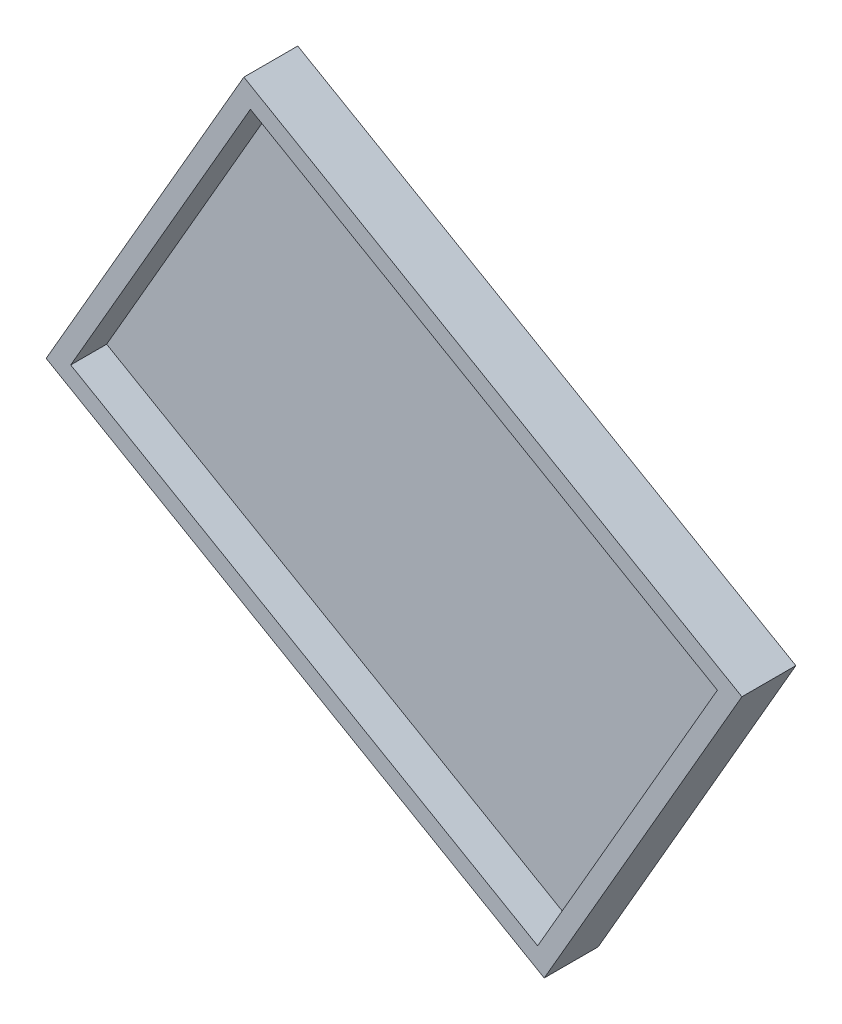
from build123d import *

# Parameters (mm, degrees)
BOSS_EXTRUDE1_DEPTH = 5
BOSS_EXTRUDE2_DEPTH = 10


with BuildPart() as part:
    # Sketch1 → Boss-Extrude1 (new body)
    with BuildSketch(Plane.XY):
        Polygon((75.131397208, 20.131397208), (20.131397208, -75.131397208), (158.695461814, -155.131397208), (213.695461814, -59.868602792), align=None)
    extrude(amount=BOSS_EXTRUDE1_DEPTH)

    # Sketch2 → Boss-Extrude2 (add)
    with BuildSketch(Plane.XY.offset(5)):
        Polygon((158.695461814, -155.131397208), (213.695461814, -59.868602792), (75.131397208, 20.131397208), (20.131397208, -75.131397208), align=None)
        Polygon((26.961524227, -73.301270189), (156.865334795, -148.301270189), (206.865334795, -61.698729811), (76.961524227, 13.301270189), align=None, mode=Mode.SUBTRACT)
    extrude(amount=BOSS_EXTRUDE2_DEPTH)


solid = part.part
